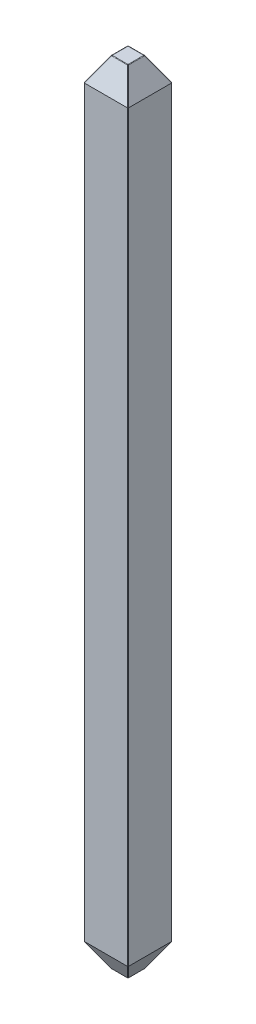
from build123d import *

# Parameters (mm, degrees)
SKETCH1_W           = 0.64
SKETCH1_H           = 0.64
BOSS_EXTRUDE1_DEPTH = 11.5
CHAMFER1_SIZE       = 0.2
CHAMFER1_SIZE2      = 0.346410162
CHAMFER2_SIZE       = 0.2
CHAMFER2_SIZE2      = 0.346410162
FILLET2_R           = 0.01


with BuildPart() as part:
    # Sketch1 → Boss-Extrude1 (new body)
    with BuildSketch(Plane(origin=(0, 0, 0), x_dir=(1, 0, 0), z_dir=(0, 1, 0))):
        Rectangle(SKETCH1_W, SKETCH1_H)
    extrude(amount=BOSS_EXTRUDE1_DEPTH)

    # Chamfer1
    chamfer1_edges = [part.edges().sort_by_distance(p)[0] for p in [
        (-0.32, 11.5, 0),
        (0, 11.5, 0.32),
        (0.32, 11.5, 0),
        (0, 11.5, -0.32),
    ]]
    chamfer1_side = [part.faces().sort_by_distance(p)[0] for p in [
        (0, 11.5, 0),
    ]]
    chamfer(chamfer1_edges, length=CHAMFER1_SIZE, length2=CHAMFER1_SIZE2, reference=chamfer1_side[0])

    # Chamfer2
    chamfer2_edges = [part.edges().sort_by_distance(p)[0] for p in [
        (0, 0, 0.32),
        (-0.32, 0, 0),
        (0, 0, -0.32),
        (0.32, 0, 0),
    ]]
    chamfer2_side = [part.faces().sort_by_distance(p)[0] for p in [
        (0, 0, 0),
    ]]
    chamfer(chamfer2_edges, length=CHAMFER2_SIZE, length2=CHAMFER2_SIZE2, reference=chamfer2_side[0])

    # Fillet2
    fillet2_edges = [part.edges().sort_by_distance(p)[0] for p in [
        (0.12, 11.5, 0),
        (0, 11.5, -0.12),
        (-0.12, 11.5, 0),
        (0, 11.5, 0.12),
        (0.32, 5.75, 0.32),
        (-0.32, 5.75, 0.32),
        (-0.32, 5.75, -0.32),
        (0.32, 5.75, -0.32),
        (-0.22, 11.326794919, -0.22),
        (0.22, 11.326794919, -0.22),
        (-0.22, 11.326794919, 0.22),
        (0.22, 11.326794919, 0.22),
        (0.12, 0, 0),
        (0, 0, 0.12),
        (-0.12, 0, 0),
        (0, 0, -0.12),
        (0.22, 0.173205081, 0.22),
        (-0.22, 0.173205081, 0.22),
        (0.22, 0.173205081, -0.22),
        (-0.22, 0.173205081, -0.22),
    ]]
    fillet(fillet2_edges, radius=FILLET2_R)


solid = part.part
